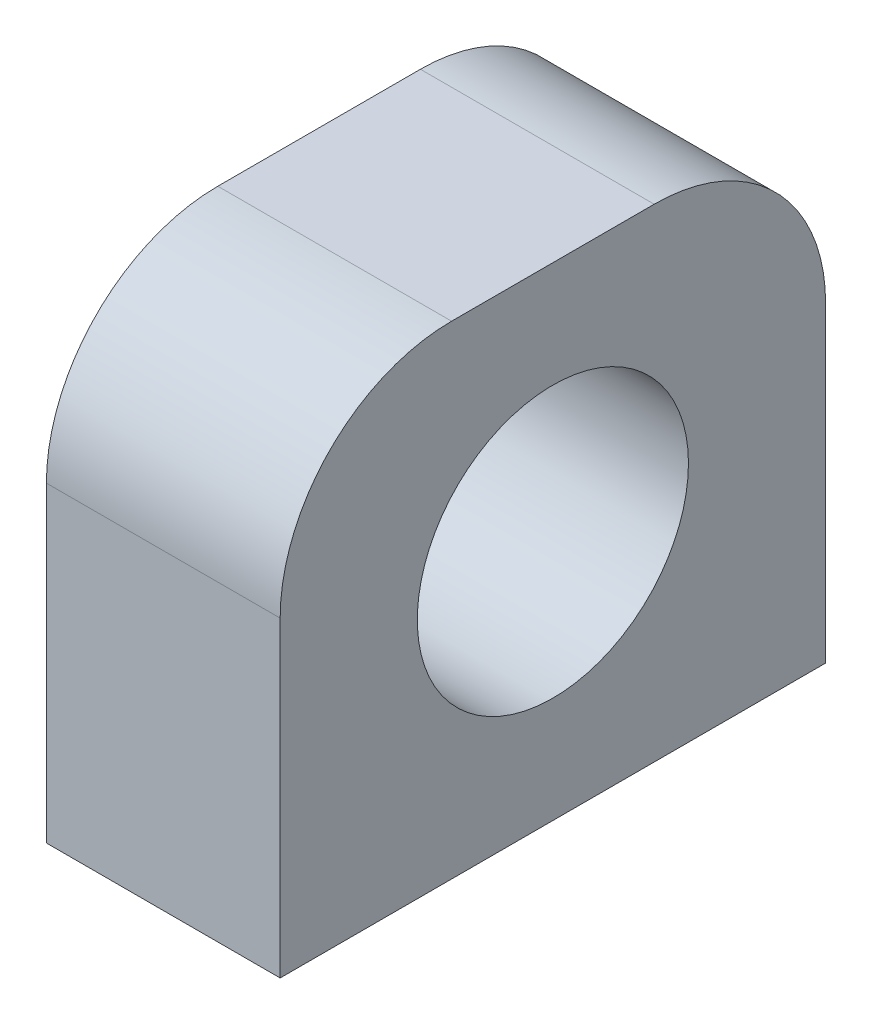
from build123d import *

# Parameters (mm, degrees)
SKETCH1_W           = 44.45
SKETCH1_H           = 39.37
BOSS_EXTRUDE1_DEPTH = 19.05
SKETCH2_R           = 11.049
CUT_EXTRUDE1_DEPTH  = 19.05
FILLET1_R           = 13.97


with BuildPart() as part:
    # Sketch1 → Boss-Extrude1 (new body)
    with BuildSketch(Plane(origin=(0, 0, 0), x_dir=(0, 0, -1), z_dir=(1, 0, 0))):
        Rectangle(SKETCH1_W, SKETCH1_H)
    extrude(amount=BOSS_EXTRUDE1_DEPTH)

    # Sketch2 → Cut-Extrude1 (cut)
    with BuildSketch(Plane(origin=(19.05, 0, 0), x_dir=(0, 0, -1), z_dir=(1, 0, 0))):
        Circle(SKETCH2_R)
    extrude(amount=-CUT_EXTRUDE1_DEPTH, mode=Mode.SUBTRACT)

    # Fillet1
    fillet1_edges = [part.edges().sort_by_distance(p)[0] for p in [
        (9.525, 19.685, 22.225),
        (9.525, 19.685, -22.225),
    ]]
    fillet(fillet1_edges, radius=FILLET1_R)


solid = part.part
